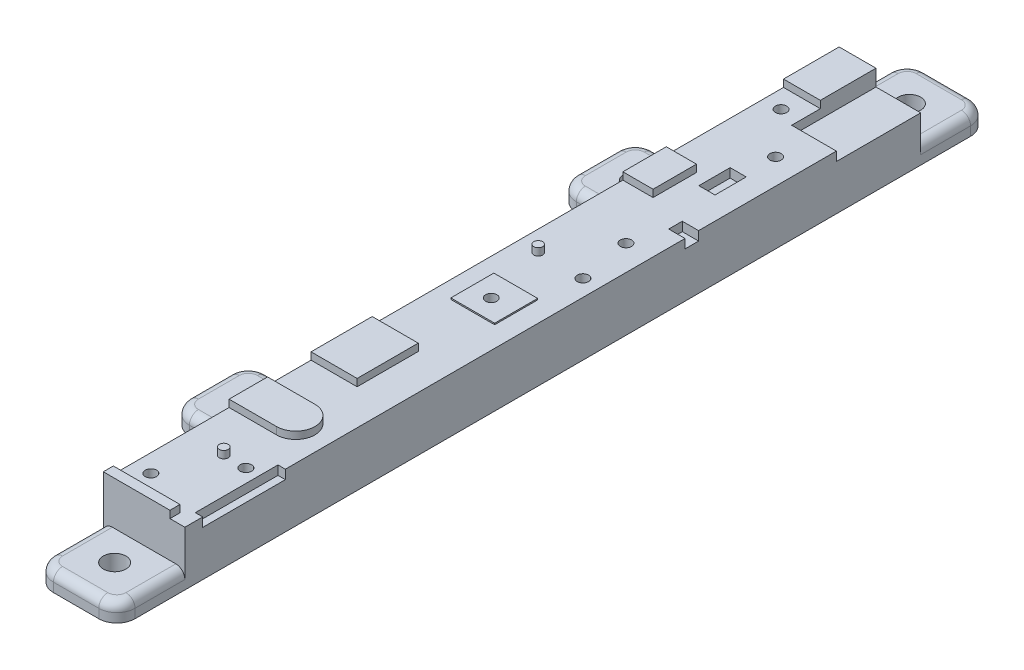
from build123d import *

# Parameters (mm, degrees)
SKETCH1_W           = 9.67
SKETCH1_H           = 9.49
SKETCH1_W_2         = 6.66
SKETCH1_H_2         = 9.58
SKETCH1_W_3         = 8.13
SKETCH1_H_3         = 12.28
SKETCH1_W_4         = 10.17
SKETCH1_H_4         = 13.49
SKETCH1_W_5         = 10.47
SKETCH1_H_5         = 8.49
SKETCH1_W_6         = 14.71
SKETCH1_H_6         = 2.21
BOSS_EXTRUDE1_DEPTH = 12
SKETCH1_4_W         = 14.71
SKETCH1_4_H         = 2.21
SKETCH1_4_W_2       = 10.47
SKETCH1_4_H_2       = 8.49
SKETCH1_4_W_3       = 10.17
SKETCH1_4_H_3       = 13.49
SKETCH1_4_W_4       = 6.66
SKETCH1_4_H_4       = 9.58
SKETCH1_4_W_5       = 8.13
SKETCH1_4_H_5       = 12.28
BOSS_EXTRUDE2_DEPTH = 1.6
SKETCH1_5_W         = 9.67
SKETCH1_5_H         = 9.49
BOSS_EXTRUDE3_DEPTH = 0.3
SKETCH2_W           = 18
SKETCH2_H           = 4
BOSS_EXTRUDE4_DEPTH = 15
SKETCH3_W           = 18
SKETCH3_H           = 4
BOSS_EXTRUDE5_DEPTH = 15
SKETCH4_W           = 17
SKETCH4_H           = 4
BOSS_EXTRUDE6_DEPTH = 15
FILLET1_R           = 4
FILLET2_R           = 2
CUT_EXTRUDE1_REACH  = 182.698
SKETCH5_R           = 2.5
SKETCH6_R           = 0.985
BOSS_EXTRUDE7_DEPTH = 1.6
CUT_EXTRUDE2_REACH  = 182.842
SKETCH6_3_R         = 1.25
CUT_EXTRUDE3_REACH  = 182.862
SKETCH7_R           = 1.25
SKETCH8_R           = 0.97
BOSS_EXTRUDE8_DEPTH = 1.6
CUT_EXTRUDE4_REACH  = 182.842
SKETCH8_3_R         = 1.25
CUT_EXTRUDE5_REACH  = 182.842
SKETCH9_R           = 1.25
SKETCH9_3_R         = 1.25
SKETCH9_3_W         = 9.87
SKETCH9_3_H         = 18.61
CUT_EXTRUDE6_DEPTH  = 1.6
CUT_EXTRUDE9_DEPTH  = 2
SKETCH11_W          = 3.56
SKETCH11_H          = 6.9
CUT_EXTRUDE10_DEPTH = 2
SKETCH14_W          = 3.6
SKETCH14_H          = 3
CUT_EXTRUDE11_DEPTH = 2
SKETCH15_W          = 1.63
SKETCH15_H          = 18.24
CUT_EXTRUDE12_DEPTH = 2


with BuildPart() as part:
    # Sketch1 → Boss-Extrude1 (new body)
    # profile 1 of 8: a face of its own
    with BuildSketch(Plane(origin=(0, 0, 0), x_dir=(1, 0, 0), z_dir=(0, 1, 0))):
        with BuildLine():
            Line((0, -162.4), (0, 0))
            Line((0, 0), (-9.87, 0))
            Line((-9.87, 0), (-9.87, -12.28))
            Line((-9.87, -12.28), (-18, -12.28))
            Line((-18, -12.28), (-18, -38.15))
            Line((-18, -38.15), (-11.34, -38.15))
            Line((-11.34, -38.15), (-11.34, -47.73))
            Line((-11.34, -47.73), (-18, -47.73))
            Line((-18, -47.73), (-18, -103.06))
            Line((-18, -103.06), (-7.83, -103.06))
            Line((-7.83, -103.06), (-7.83, -116.55))
            Line((-7.83, -116.55), (-18, -116.55))
            Line((-18, -116.55), (-18, -126.15))
            Line((-18, -126.15), (-7.53, -126.15))
            ThreePointArc((-7.53, -126.15), (-3.285, -130.395), (-7.53, -134.64))
            Line((-7.53, -134.64), (-18, -134.64))
            Line((-18, -134.64), (-18, -160.19))
            Line((-18, -160.19), (-3.29, -160.19))
            Line((-3.29, -160.19), (-3.29, -162.4))
            Line((-3.29, -162.4), (0, -162.4))
        make_face()
        with Locations((-9.345, -84.775)):
            Rectangle(SKETCH1_W, SKETCH1_H, mode=Mode.SUBTRACT)
    # profile 2 of 8: a face of its own
    with BuildSketch(Plane(origin=(0, 0, 0), x_dir=(1, 0, 0), z_dir=(0, 1, 0))):
        with Locations((-9.345, -84.775)):
            Rectangle(SKETCH1_W, SKETCH1_H)
    # profile 3 of 8: a face of its own
    with BuildSketch(Plane(origin=(0, 0, 0), x_dir=(1, 0, 0), z_dir=(0, 1, 0))):
        with Locations((-14.67, -42.94)):
            Rectangle(SKETCH1_W_2, SKETCH1_H_2)
    # profile 4 of 8: a face of its own
    with BuildSketch(Plane(origin=(0, 0, 0), x_dir=(1, 0, 0), z_dir=(0, 1, 0))):
        with Locations((-13.935, -6.14)):
            Rectangle(SKETCH1_W_3, SKETCH1_H_3)
    # profile 5 of 8: a face of its own
    with BuildSketch(Plane(origin=(0, 0, 0), x_dir=(1, 0, 0), z_dir=(0, 1, 0))):
        with Locations((-12.915, -109.805)):
            Rectangle(SKETCH1_W_4, SKETCH1_H_4)
    # profile 6 of 8: a face of its own
    with BuildSketch(Plane(origin=(0, 0, 0), x_dir=(1, 0, 0), z_dir=(0, 1, 0))):
        with Locations((-12.765, -130.395)):
            Rectangle(SKETCH1_W_5, SKETCH1_H_5)
    # profile 7 of 8: a face of its own
    with BuildSketch(Plane(origin=(0, 0, 0), x_dir=(1, 0, 0), z_dir=(0, 1, 0))):
        with BuildLine():
            Line((-7.53, -126.15), (-7.53, -134.64))
            ThreePointArc((-7.53, -134.64), (-3.285, -130.395), (-7.53, -126.15))
        make_face()
    # profile 8 of 8: a face of its own
    with BuildSketch(Plane(origin=(0, 0, 0), x_dir=(1, 0, 0), z_dir=(0, 1, 0))):
        with Locations((-10.645, -161.295)):
            Rectangle(SKETCH1_W_6, SKETCH1_H_6)
    extrude(amount=-BOSS_EXTRUDE1_DEPTH)

    # Sketch1<4> → Boss-Extrude2 (add)
    with BuildSketch(Plane(origin=(0, 0, 0), x_dir=(1, 0, 0), z_dir=(0, 1, 0))):
        with Locations((-10.645, -161.295)):
            Rectangle(SKETCH1_4_W, SKETCH1_4_H)
        with Locations((-12.765, -130.395)):
            Rectangle(SKETCH1_4_W_2, SKETCH1_4_H_2)
        with BuildLine():
            Line((-7.53, -126.15), (-7.53, -134.64))
            ThreePointArc((-7.53, -134.64), (-3.285, -130.395), (-7.53, -126.15))
        make_face()
        with Locations((-12.915, -109.805)):
            Rectangle(SKETCH1_4_W_3, SKETCH1_4_H_3)
        with Locations((-14.67, -42.94)):
            Rectangle(SKETCH1_4_W_4, SKETCH1_4_H_4)
        with Locations((-13.935, -6.14)):
            Rectangle(SKETCH1_4_W_5, SKETCH1_4_H_5)
    extrude(amount=BOSS_EXTRUDE2_DEPTH)

    # Sketch1<5> → Boss-Extrude3 (add)
    with BuildSketch(Plane(origin=(0, 0, 0), x_dir=(1, 0, 0), z_dir=(0, 1, 0))):
        with Locations((-9.345, -84.775)):
            Rectangle(SKETCH1_5_W, SKETCH1_5_H)
    extrude(amount=BOSS_EXTRUDE3_DEPTH)

    # Sketch2 → Boss-Extrude4 (add)
    with BuildSketch(Plane.XY.offset(162.4)):
        with Locations((-9, -10)):
            Rectangle(SKETCH2_W, SKETCH2_H)
    extrude(amount=BOSS_EXTRUDE4_DEPTH)

    # Sketch3 → Boss-Extrude5 (add)
    with BuildSketch(Plane(origin=(0, 0, 0), x_dir=(-1, 0, 0), z_dir=(0, 0, -1))):
        with Locations((9, -10)):
            Rectangle(SKETCH3_W, SKETCH3_H)
    extrude(amount=BOSS_EXTRUDE5_DEPTH)

    # Sketch4 → Boss-Extrude6 (add)
    with BuildSketch(Plane.ZY.offset(18)):
        with Locations((38.5, -10)):
            Rectangle(SKETCH4_W, SKETCH4_H)
        with Locations((123.9, -10)):
            Rectangle(SKETCH4_W, SKETCH4_H)
    extrude(amount=BOSS_EXTRUDE6_DEPTH)

    # Fillet1
    fillet1_edges = [part.edges().sort_by_distance(p)[0] for p in [
        (-18, -10, 177.4),
        (0, -10, 177.4),
        (0, -10, -15),
        (-18, -10, -15),
        (-33, -10, 30),
        (-33, -10, 47),
        (-33, -10, 115.4),
        (-33, -10, 132.4),
    ]]
    fillet(fillet1_edges, radius=FILLET1_R)

    # Fillet2
    fillet2_edges = [part.edges().sort_by_distance(p)[0] for p in [
        (-9, -8, 177.4),
        (0, -8, 167.9),
        (-16.828427125, -8, 176.228427125),
        (-1.171572875, -8, 176.228427125),
        (0, -8, -5.5),
        (-33, -8, 123.9),
        (-23.5, -8, 115.4),
        (-23.5, -8, 132.4),
        (-31.828427125, -8, 116.571572875),
        (-31.828427125, -8, 131.228427125),
        (-33, -8, 38.5),
        (-23.5, -8, 30),
        (-23.5, -8, 47),
        (-31.828427125, -8, 31.171572875),
        (-31.828427125, -8, 45.828427125),
        (-9, -8, -15),
        (-16.828427125, -8, -13.828427125),
        (-1.171572875, -8, -13.828427125),
    ]]
    fillet(fillet2_edges, radius=FILLET2_R)

    # Sketch5 → Cut-Extrude1 (cut, up to next)
    with BuildSketch(Plane(origin=(0, -8, 0), x_dir=(1, 0, 0), z_dir=(0, 1, 0)), mode=Mode.PRIVATE) as cut_extrude1_sk1:
        with Locations(Location((-9, 6.5, 0), (0, 0, 270))):
            Circle(SKETCH5_R)
    cut_extrude1_tool1 = extrude(cut_extrude1_sk1.sketch, amount=-CUT_EXTRUDE1_REACH, mode=Mode.PRIVATE) & part.part
    # Sketch5 → Cut-Extrude1 (cut, up to next)
    with BuildSketch(Plane(origin=(0, -8, 0), x_dir=(1, 0, 0), z_dir=(0, 1, 0)), mode=Mode.PRIVATE) as cut_extrude1_sk2:
        with Locations(Location((-24.5, -38.5, 0), (0, 0, 270))):
            Circle(SKETCH5_R)
    cut_extrude1_tool2 = extrude(cut_extrude1_sk2.sketch, amount=-CUT_EXTRUDE1_REACH, mode=Mode.PRIVATE) & part.part
    # Sketch5 → Cut-Extrude1 (cut, up to next)
    with BuildSketch(Plane(origin=(0, -8, 0), x_dir=(1, 0, 0), z_dir=(0, 1, 0)), mode=Mode.PRIVATE) as cut_extrude1_sk3:
        with Locations(Location((-24.5, -123.9, 0), (0, 0, 270))):
            Circle(SKETCH5_R)
    cut_extrude1_tool3 = extrude(cut_extrude1_sk3.sketch, amount=-CUT_EXTRUDE1_REACH, mode=Mode.PRIVATE) & part.part
    # Sketch5 → Cut-Extrude1 (cut, up to next)
    with BuildSketch(Plane(origin=(0, -8, 0), x_dir=(1, 0, 0), z_dir=(0, 1, 0)), mode=Mode.PRIVATE) as cut_extrude1_sk4:
        with Locations(Location((-9, -168.9, 0), (0, 0, 270))):
            Circle(SKETCH5_R)
    cut_extrude1_tool4 = extrude(cut_extrude1_sk4.sketch, amount=-CUT_EXTRUDE1_REACH, mode=Mode.PRIVATE) & part.part
    add(cut_extrude1_tool1.solids().sort_by_distance((-9, -8, -6.5))[0], mode=Mode.SUBTRACT)
    add(cut_extrude1_tool2.solids().sort_by_distance((-24.5, -8, 38.5))[0], mode=Mode.SUBTRACT)
    add(cut_extrude1_tool3.solids().sort_by_distance((-24.5, -8, 123.9))[0], mode=Mode.SUBTRACT)
    add(cut_extrude1_tool4.solids().sort_by_distance((-9, -8, 168.9))[0], mode=Mode.SUBTRACT)

    # Sketch6 → Boss-Extrude7 (add)
    with BuildSketch(Plane(origin=(0, 0, 0), x_dir=(1, 0, 0), z_dir=(0, 1, 0))):
        with Locations(Location((-9.46, -144.344765373, 0), (0, 0, 270))):
            Circle(SKETCH6_R)
    extrude(amount=BOSS_EXTRUDE7_DEPTH)

    # Sketch6<3> → Cut-Extrude2 (cut, up to next)
    with BuildSketch(Plane(origin=(0, 0, 0), x_dir=(1, 0, 0), z_dir=(0, 1, 0)), mode=Mode.PRIVATE) as cut_extrude2_sk1:
        with Locations(Location((-14.04, -155.86, 0), (0, 0, 270))):
            Circle(SKETCH6_3_R)
    cut_extrude2_tool1 = extrude(cut_extrude2_sk1.sketch, amount=-CUT_EXTRUDE2_REACH, mode=Mode.PRIVATE) & part.part
    # Sketch6<3> → Cut-Extrude2 (cut, up to next)
    with BuildSketch(Plane(origin=(0, 0, 0), x_dir=(1, 0, 0), z_dir=(0, 1, 0)), mode=Mode.PRIVATE) as cut_extrude2_sk2:
        with Locations(Location((-4.59, -144.344765373, 0), (0, 0, 270))):
            Circle(SKETCH6_3_R)
    cut_extrude2_tool2 = extrude(cut_extrude2_sk2.sketch, amount=-CUT_EXTRUDE2_REACH, mode=Mode.PRIVATE) & part.part
    add(cut_extrude2_tool1.solids().sort_by_distance((-14.04, 0, 155.86))[0], mode=Mode.SUBTRACT)
    add(cut_extrude2_tool2.solids().sort_by_distance((-4.59, 0, 144.344765))[0], mode=Mode.SUBTRACT)

    # Sketch7 → Cut-Extrude3 (cut, up to next)
    with BuildSketch(Plane(origin=(0, 0.3, 0), x_dir=(1, 0, 0), z_dir=(0, 1, 0)), mode=Mode.PRIVATE) as cut_extrude3_sk1:
        with Locations(Location((-9.705, -85.075, 0), (0, 0, 270))):
            Circle(SKETCH7_R)
    cut_extrude3_tool1 = extrude(cut_extrude3_sk1.sketch, amount=-CUT_EXTRUDE3_REACH, mode=Mode.PRIVATE) & part.part
    add(cut_extrude3_tool1.solids().sort_by_distance((-9.705, 0.3, 85.075))[0], mode=Mode.SUBTRACT)

    # Sketch8 → Boss-Extrude8 (add)
    with BuildSketch(Plane(origin=(0, 0, 0), x_dir=(1, 0, 0), z_dir=(0, 1, 0))):
        with Locations(Location((-13.505, -70.905, 0), (0, 0, 270))):
            Circle(SKETCH8_R)
    extrude(amount=BOSS_EXTRUDE8_DEPTH)

    # Sketch8<3> → Cut-Extrude4 (cut, up to next)
    with BuildSketch(Plane(origin=(0, 0, 0), x_dir=(1, 0, 0), z_dir=(0, 1, 0)), mode=Mode.PRIVATE) as cut_extrude4_sk1:
        with Locations(Location((-3.64, -70.905, 0), (0, 0, 270))):
            Circle(SKETCH8_3_R)
    cut_extrude4_tool1 = extrude(cut_extrude4_sk1.sketch, amount=-CUT_EXTRUDE4_REACH, mode=Mode.PRIVATE) & part.part
    add(cut_extrude4_tool1.solids().sort_by_distance((-3.64, 0, 70.905))[0], mode=Mode.SUBTRACT)

    # Sketch9 → Cut-Extrude5 (cut, up to next)
    with BuildSketch(Plane(origin=(0, 0, 0), x_dir=(1, 0, 0), z_dir=(0, 1, 0)), mode=Mode.PRIVATE) as cut_extrude5_sk1:
        with Locations(Location((-5.61, -59.44, 0), (0, 0, 270))):
            Circle(SKETCH9_R)
    cut_extrude5_tool1 = extrude(cut_extrude5_sk1.sketch, amount=-CUT_EXTRUDE5_REACH, mode=Mode.PRIVATE) & part.part
    # Sketch9 → Cut-Extrude5 (cut, up to next)
    with BuildSketch(Plane(origin=(0, 0, 0), x_dir=(1, 0, 0), z_dir=(0, 1, 0)), mode=Mode.PRIVATE) as cut_extrude5_sk2:
        with Locations(Location((-5.61, -26.42, 0), (0, 0, 270))):
            Circle(SKETCH9_R)
    cut_extrude5_tool2 = extrude(cut_extrude5_sk2.sketch, amount=-CUT_EXTRUDE5_REACH, mode=Mode.PRIVATE) & part.part
    # Sketch9 → Cut-Extrude5 (cut, up to next)
    with BuildSketch(Plane(origin=(0, 0, 0), x_dir=(1, 0, 0), z_dir=(0, 1, 0)), mode=Mode.PRIVATE) as cut_extrude5_sk3:
        with Locations(Location((-14.09, -16.73, 0), (0, 0, 270))):
            Circle(SKETCH9_R)
    cut_extrude5_tool3 = extrude(cut_extrude5_sk3.sketch, amount=-CUT_EXTRUDE5_REACH, mode=Mode.PRIVATE) & part.part
    add(cut_extrude5_tool1.solids().sort_by_distance((-5.61, 0, 59.44))[0], mode=Mode.SUBTRACT)
    add(cut_extrude5_tool2.solids().sort_by_distance((-5.61, 0, 26.42))[0], mode=Mode.SUBTRACT)
    add(cut_extrude5_tool3.solids().sort_by_distance((-14.09, 0, 16.73))[0], mode=Mode.SUBTRACT)

    # Sketch9<3> → Cut-Extrude6 (cut)
    with BuildSketch(Plane(origin=(0, 0, 0), x_dir=(1, 0, 0), z_dir=(0, 1, 0))):
        with Locations(Location((-5.61, -59.44, 0), (0, 0, 270))):
            Circle(SKETCH9_3_R)
        with Locations(Location((-5.61, -26.42, 0), (0, 0, 270))):
            Circle(SKETCH9_3_R)
        with Locations(Location((-14.09, -16.73, 0), (0, 0, 270))):
            Circle(SKETCH9_3_R)
        with Locations((-4.935, -9.305)):
            Rectangle(SKETCH9_3_W, SKETCH9_3_H)
    extrude(amount=-CUT_EXTRUDE6_DEPTH, mode=Mode.SUBTRACT)

    # Sketch9<4> → Cut-Extrude9 (cut)
    with BuildSketch(Plane(origin=(0, 0, 0), x_dir=(1, 0, 0), z_dir=(0, 1, 0))):
        Polygon((0, -18.61), (0, 0), (-9.87, 0), (-9.87, -12.28), (-9.87, -18.61), align=None)
    extrude(amount=-CUT_EXTRUDE9_DEPTH, mode=Mode.SUBTRACT)

    # Sketch11 → Cut-Extrude10 (cut)
    with BuildSketch(Plane(origin=(0, 0, 0), x_dir=(1, 0, 0), z_dir=(0, 1, 0))):
        with Locations((-6.78, -36.95)):
            Rectangle(SKETCH11_W, SKETCH11_H)
    extrude(amount=-CUT_EXTRUDE10_DEPTH, mode=Mode.SUBTRACT)

    # Sketch14 → Cut-Extrude11 (cut)
    with BuildSketch(Plane(origin=(0, 0, 0), x_dir=(1, 0, 0), z_dir=(0, 1, 0))):
        with Locations((-1.8, -50.52)):
            Rectangle(SKETCH14_W, SKETCH14_H)
    extrude(amount=-CUT_EXTRUDE11_DEPTH, mode=Mode.SUBTRACT)

    # Sketch15 → Cut-Extrude12 (cut)
    with BuildSketch(Plane(origin=(0, 0, 0), x_dir=(1, 0, 0), z_dir=(0, 1, 0))):
        with Locations((-0.815, -149.34)):
            Rectangle(SKETCH15_W, SKETCH15_H)
    extrude(amount=-CUT_EXTRUDE12_DEPTH, mode=Mode.SUBTRACT)


solid = part.part
